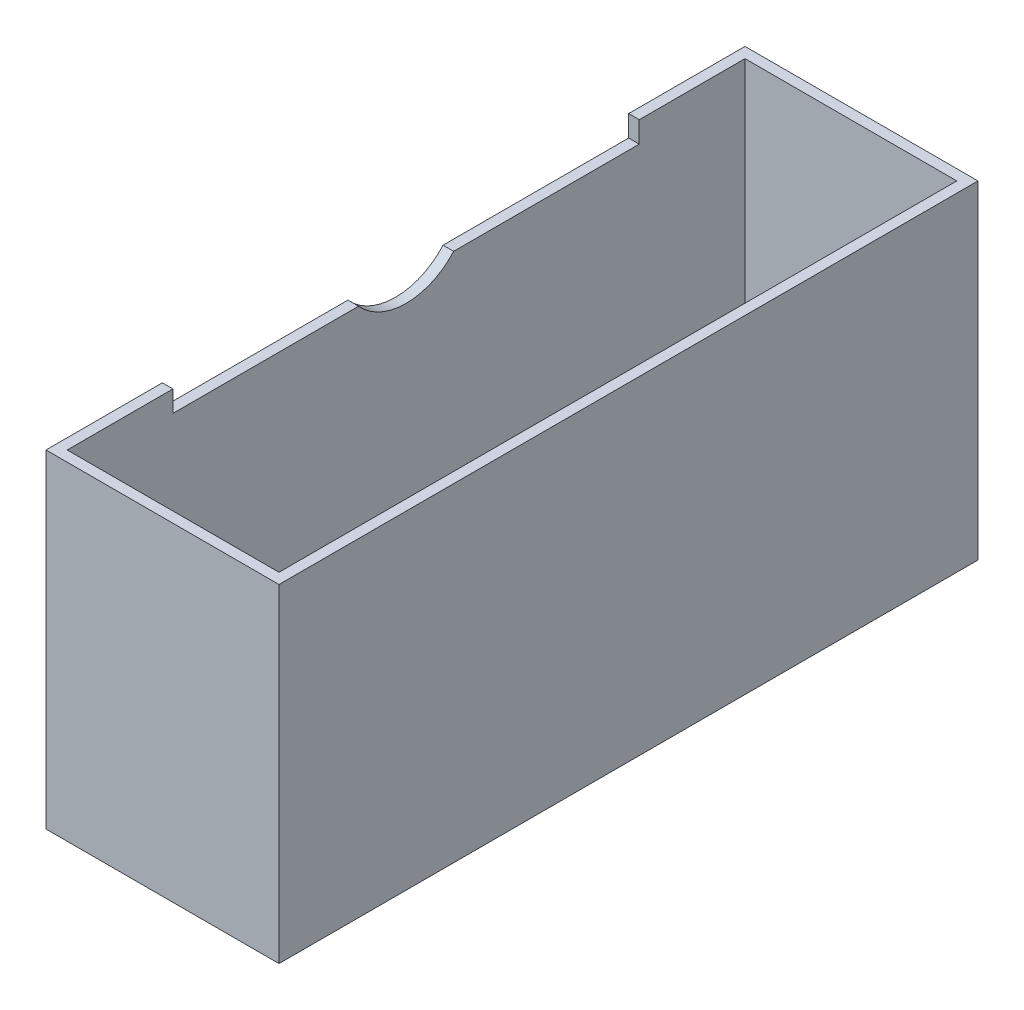
from build123d import *

# Parameters (mm, degrees)
SKETCH1_W           = 69.85
SKETCH1_H           = 209.55
BOSS_EXTRUDE1_DEPTH = 98.425
SKETCH2_W           = 63.5
SKETCH2_H           = 203.2
CUT_EXTRUDE1_DEPTH  = 95.25
CUT_EXTRUDE2_DEPTH  = 3.175


with BuildPart() as part:
    # Sketch1 → Boss-Extrude1 (new body)
    with BuildSketch(Plane(origin=(0, 0, 0), x_dir=(1, 0, 0), z_dir=(0, 1, 0))):
        Rectangle(SKETCH1_W, SKETCH1_H)
    extrude(amount=BOSS_EXTRUDE1_DEPTH)

    # Sketch2 → Cut-Extrude1 (cut)
    with BuildSketch(Plane(origin=(0, 98.425, 0), x_dir=(1, 0, 0), z_dir=(0, 1, 0))):
        Rectangle(SKETCH2_W, SKETCH2_H)
    extrude(amount=-CUT_EXTRUDE1_DEPTH, mode=Mode.SUBTRACT)

    # Sketch3 → Cut-Extrude2 (cut)
    with BuildSketch(Plane.ZY.offset(34.925)):
        with BuildLine():
            Line((-69.896994772, 98.425), (-69.896994772, 178.106960935))
            Line((-69.896994772, 178.106960935), (69.896994772, 178.106960935))
            Line((69.896994772, 178.106960935), (69.896994772, 98.425))
            Line((69.896994772, 98.425), (69.896994772, 92.075))
            Line((69.896994772, 92.075), (14.246026429, 92.075))
            ThreePointArc((14.246026429, 92.075), (0, 85.672261798), (-14.246026429, 92.075))
            Line((-14.246026429, 92.075), (-69.896994772, 92.075))
            Line((-69.896994772, 92.075), (-69.896994772, 98.425))
        make_face()
    extrude(amount=-CUT_EXTRUDE2_DEPTH, mode=Mode.SUBTRACT)


solid = part.part
